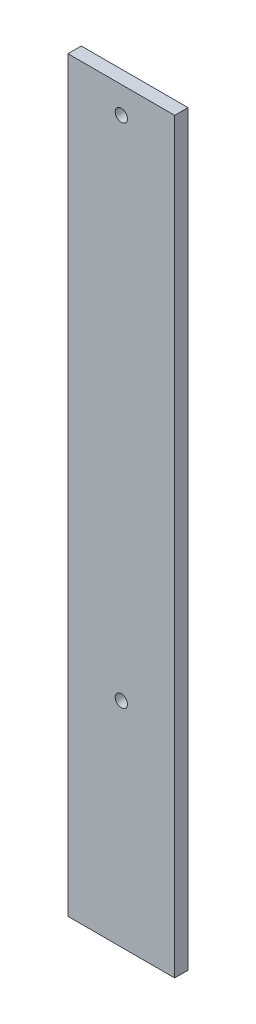
from build123d import *

# Parameters (mm, degrees)
SKETCH2_W           = 25.4
SKETCH2_H           = 177.8
SKETCH2_R           = 1.4605
BOSS_EXTRUDE1_DEPTH = 3.175


with BuildPart() as part:
    # Sketch2 → Boss-Extrude1 (new body)
    with BuildSketch(Plane.XY):
        with Locations((12.7, 88.9)):
            Rectangle(SKETCH2_W, SKETCH2_H)
        with Locations((12.7, 171.45)):
            Circle(SKETCH2_R, mode=Mode.SUBTRACT)
        with Locations((12.7, 50.8)):
            Circle(SKETCH2_R, mode=Mode.SUBTRACT)
    extrude(amount=BOSS_EXTRUDE1_DEPTH)


solid = part.part
